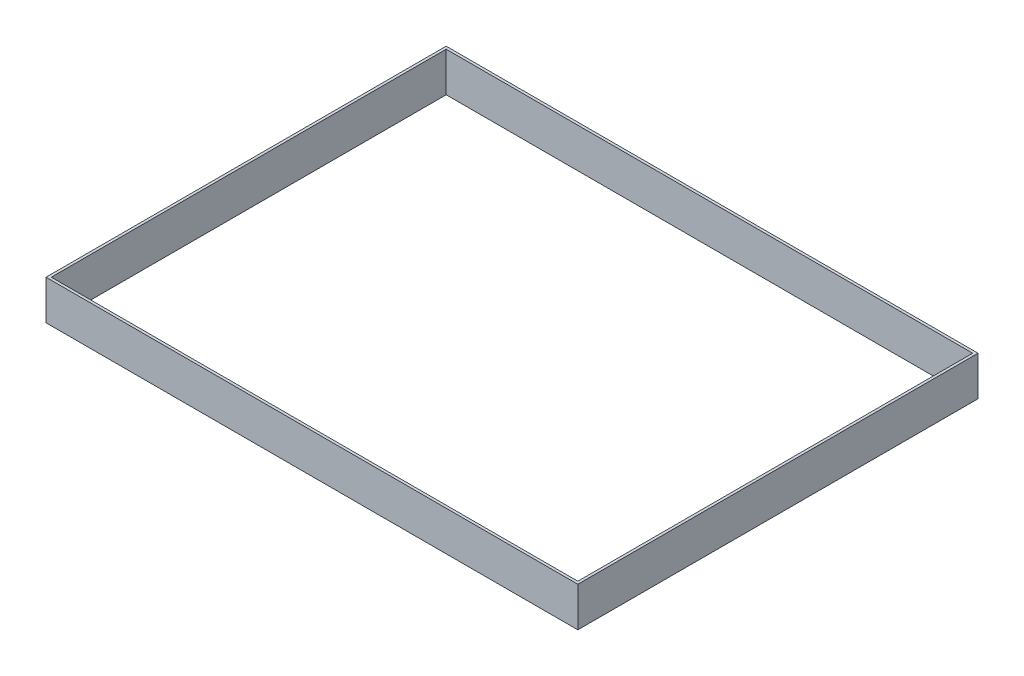
from build123d import *

# Parameters (mm, degrees)
SKETCH_1_W      = 40.4
SKETCH_1_H      = 30.4
SKETCH_1_W_2    = 40
SKETCH_1_H_2    = 30
EXTRUDE_1_DEPTH = 3


with BuildPart() as part:
    # 草图1 → 凸台-拉伸1 (new body)
    with BuildSketch(Plane(origin=(0, 0, 0), x_dir=(1, 0, 0), z_dir=(0, 1, 0))):
        Rectangle(SKETCH_1_W, SKETCH_1_H)
        Rectangle(SKETCH_1_W_2, SKETCH_1_H_2, mode=Mode.SUBTRACT)
    extrude(amount=EXTRUDE_1_DEPTH)


solid = part.part
